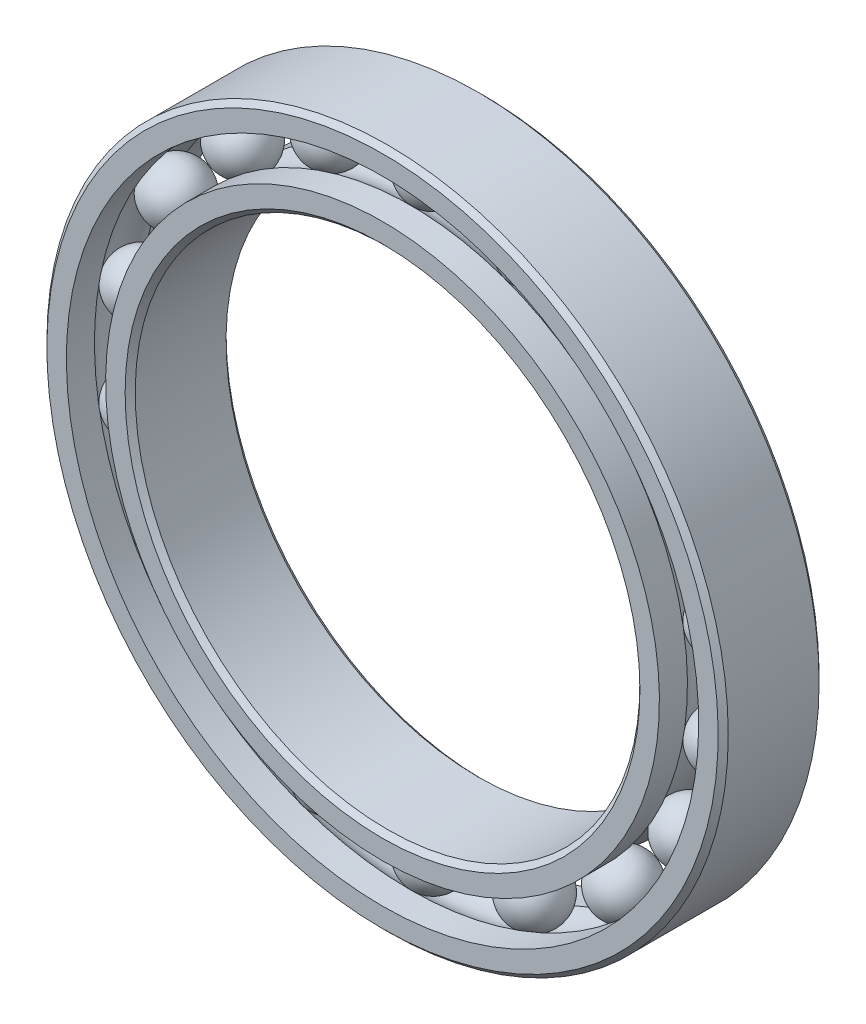
from build123d import *

# Parameters (mm, degrees)
CIRPATTERN1_COUNT = 18


with BuildPart() as part:
    # Sketch6 → Revolve5 (revolve)
    with BuildSketch(Plane(origin=(0, 0, 0), x_dir=(0, 0, -1), z_dir=(1, 0, 0)), mode=Mode.PRIVATE) as revolve5_sk:
        with BuildLine():
            Line((1.8, 13.5), (2, 13.3))
            Line((2, 13.3), (2, 12.527777778))
            Line((2, 12.527777778), (0.888888889, 12.527777778))
            ThreePointArc((0.888888889, 12.527777778), (0, 12.931127313), (-0.888888889, 12.527777778))
            Line((-0.888888889, 12.527777778), (-2, 12.527777778))
            Line((-2, 12.527777778), (-2, 13.3))
            Line((-2, 13.3), (-1.8, 13.5))
            Line((-1.8, 13.5), (1.8, 13.5))
        make_face()
    revolve(revolve5_sk.sketch.rotate(Axis((0, 0, 2), (0, 0, -1)), 180), axis=Axis((0, 0, 2), (0, 0, -1)))


with BuildPart() as body_2:
    # Sketch3 → Revolve3 (revolve)
    with BuildSketch(Plane(origin=(0, 0, 0), x_dir=(0, 0, -1), z_dir=(1, 0, 0)), mode=Mode.PRIVATE) as revolve3_sk:
        with BuildLine():
            Line((-2, 10.972222222), (-0.888888889, 10.972222222))
            ThreePointArc((-0.888888889, 10.972222222), (0, 10.568872687), (0.888888889, 10.972222222))
            Line((0.888888889, 10.972222222), (2, 10.972222222))
            Line((2, 10.972222222), (2, 10.2))
            Line((2, 10.2), (1.8, 10))
            Line((1.8, 10), (-1.8, 10))
            Line((-1.8, 10), (-2, 10.2))
            Line((-2, 10.2), (-2, 10.972222222))
        make_face()
    revolve(revolve3_sk.sketch.rotate(Axis((0, 0, 2), (0, 0, -1)), 180), axis=Axis((0, 0, 2), (0, 0, -1)))


with BuildPart() as body_3:
    # Sketch4 → Revolve4 (revolve)
    with BuildSketch(Plane(origin=(0, 0, 0), x_dir=(0, 0, -1), z_dir=(1, 0, 0))):
        with BuildLine():
            Line((-1.181127313, 11.75), (1.181127313, 11.75))
            ThreePointArc((1.181127313, 11.75), (0, 12.931127313), (-1.181127313, 11.75))
        make_face()
    revolve(axis=Axis((0, 11.75, 1.181127313), (0, 0, -1)))


with BuildPart() as cirpattern1_1:
    # CirPattern1: pattern copy
    add(body_3.part.rotate(Axis((0, 0, 0), (0, 0, 1)), 1 * 360 / CIRPATTERN1_COUNT))


with BuildPart() as cirpattern1_2:
    # CirPattern1: pattern copy
    add(body_3.part.rotate(Axis((0, 0, 0), (0, 0, 1)), 2 * 360 / CIRPATTERN1_COUNT))


with BuildPart() as cirpattern1_3:
    # CirPattern1: pattern copy
    add(body_3.part.rotate(Axis((0, 0, 0), (0, 0, 1)), 3 * 360 / CIRPATTERN1_COUNT))


with BuildPart() as cirpattern1_4:
    # CirPattern1: pattern copy
    add(body_3.part.rotate(Axis((0, 0, 0), (0, 0, 1)), 4 * 360 / CIRPATTERN1_COUNT))


with BuildPart() as cirpattern1_5:
    # CirPattern1: pattern copy
    add(body_3.part.rotate(Axis((0, 0, 0), (0, 0, 1)), 5 * 360 / CIRPATTERN1_COUNT))


with BuildPart() as cirpattern1_6:
    # CirPattern1: pattern copy
    add(body_3.part.rotate(Axis((0, 0, 0), (0, 0, 1)), 6 * 360 / CIRPATTERN1_COUNT))


with BuildPart() as cirpattern1_7:
    # CirPattern1: pattern copy
    add(body_3.part.rotate(Axis((0, 0, 0), (0, 0, 1)), 7 * 360 / CIRPATTERN1_COUNT))


with BuildPart() as cirpattern1_8:
    # CirPattern1: pattern copy
    add(body_3.part.rotate(Axis((0, 0, 0), (0, 0, 1)), 8 * 360 / CIRPATTERN1_COUNT))


with BuildPart() as cirpattern1_9:
    # CirPattern1: pattern copy
    add(body_3.part.rotate(Axis((0, 0, 0), (0, 0, 1)), 9 * 360 / CIRPATTERN1_COUNT))


with BuildPart() as cirpattern1_10:
    # CirPattern1: pattern copy
    add(body_3.part.rotate(Axis((0, 0, 0), (0, 0, 1)), 10 * 360 / CIRPATTERN1_COUNT))


with BuildPart() as cirpattern1_11:
    # CirPattern1: pattern copy
    add(body_3.part.rotate(Axis((0, 0, 0), (0, 0, 1)), 11 * 360 / CIRPATTERN1_COUNT))


with BuildPart() as cirpattern1_12:
    # CirPattern1: pattern copy
    add(body_3.part.rotate(Axis((0, 0, 0), (0, 0, 1)), 12 * 360 / CIRPATTERN1_COUNT))


with BuildPart() as cirpattern1_13:
    # CirPattern1: pattern copy
    add(body_3.part.rotate(Axis((0, 0, 0), (0, 0, 1)), 13 * 360 / CIRPATTERN1_COUNT))


with BuildPart() as cirpattern1_14:
    # CirPattern1: pattern copy
    add(body_3.part.rotate(Axis((0, 0, 0), (0, 0, 1)), 14 * 360 / CIRPATTERN1_COUNT))


with BuildPart() as cirpattern1_15:
    # CirPattern1: pattern copy
    add(body_3.part.rotate(Axis((0, 0, 0), (0, 0, 1)), 15 * 360 / CIRPATTERN1_COUNT))


with BuildPart() as cirpattern1_16:
    # CirPattern1: pattern copy
    add(body_3.part.rotate(Axis((0, 0, 0), (0, 0, 1)), 16 * 360 / CIRPATTERN1_COUNT))


with BuildPart() as cirpattern1_17:
    # CirPattern1: pattern copy
    add(body_3.part.rotate(Axis((0, 0, 0), (0, 0, 1)), 17 * 360 / CIRPATTERN1_COUNT))


solid = Compound([part.part, body_2.part, body_3.part, cirpattern1_1.part, cirpattern1_2.part, cirpattern1_3.part, cirpattern1_4.part, cirpattern1_5.part, cirpattern1_6.part, cirpattern1_7.part, cirpattern1_8.part, cirpattern1_9.part, cirpattern1_10.part, cirpattern1_11.part, cirpattern1_12.part, cirpattern1_13.part, cirpattern1_14.part, cirpattern1_15.part, cirpattern1_16.part, cirpattern1_17.part])
